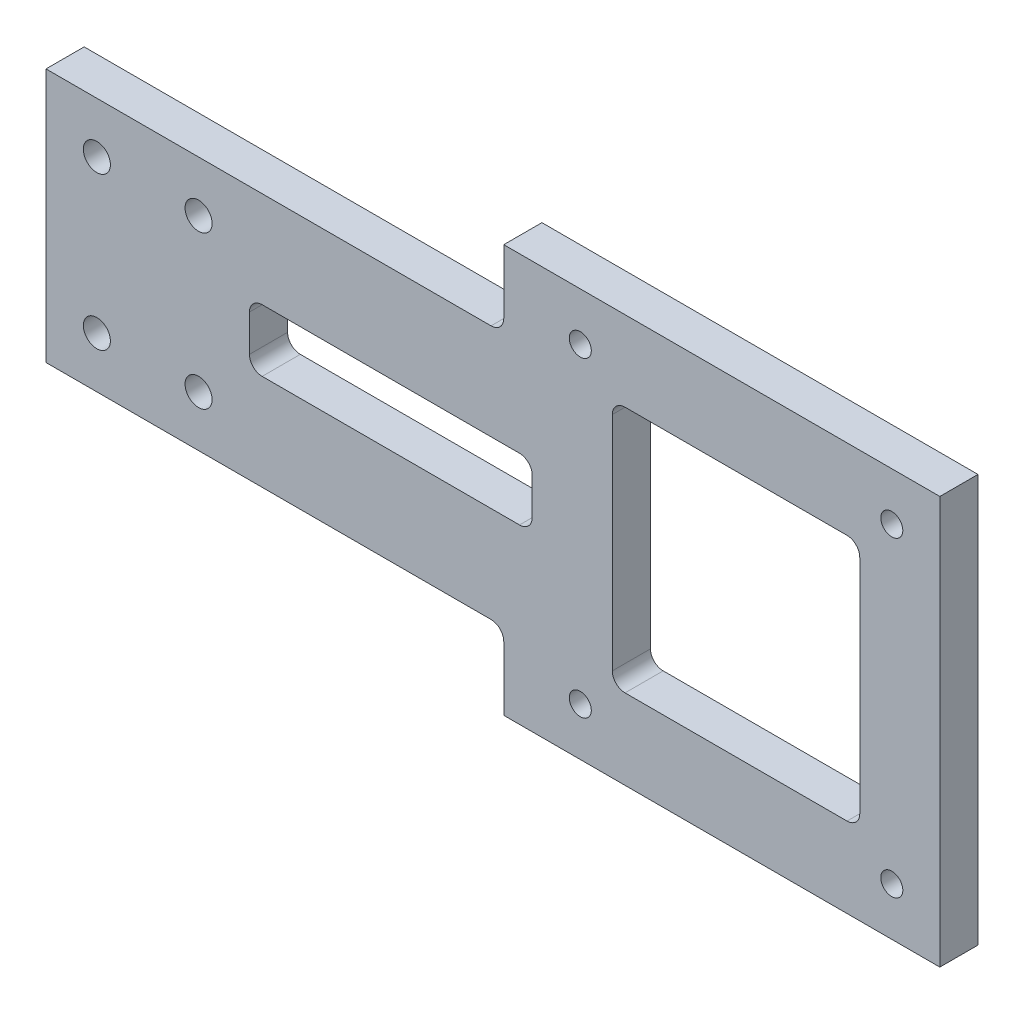
from build123d import *

# Parameters (mm, degrees)
BOSS_EXTRUDE1_DEPTH         = 9.525
M5_CLEARANCE_HOLE1_D        = 5.5
M5_CLEARANCE_HOLE1_DEPTH    = 18.75
M5_CLEARANCE_HOLE1_TIP      = 1.652366702
FILLET1_R                   = 3.175
F_1_4_CLEARANCE_HOLE1_D     = 6.7564
F_1_4_CLEARANCE_HOLE1_DEPTH = 18.75
F_1_4_CLEARANCE_HOLE1_TIP   = 2.029827343
SKETCH7_W                   = 70.609127035
SKETCH7_H                   = 15.5
CUT_EXTRUDE1_DEPTH          = 199.318467163
FILLET2_R                   = 3.175
SKETCH8_W                   = 20
SKETCH8_H                   = 61.78174593
BOSS_EXTRUDE2_DEPTH         = 9.525
FILLET3_R                   = 3.175


with BuildPart() as part:
    # Sketch1 → Boss-Extrude1 (new body)
    with BuildSketch(Plane.XY):
        Polygon((82.55, 31.75), (82.55, 50.890872965), (191.440872965, 50.890872965), (191.440872965, 30.890872965), (109.659127035, 30.890872965), (109.659127035, -30.890872965), (191.440872965, -30.890872965), (191.440872965, -50.890872965), (82.55, -50.890872965), (82.55, -31.75), (-31.75, -31.75), (-31.75, 31.75), align=None)
    extrude(amount=BOSS_EXTRUDE1_DEPTH)

    # M5 Clearance Hole1
    with Locations(Plane.XY.offset(9.525)):
        with Locations((179.440872965, 38.890872965), (179.440872965, -38.890872965), (101.659127035, 38.890872965), (101.659127035, -38.890872965)):
            Hole(M5_CLEARANCE_HOLE1_D / 2, depth=M5_CLEARANCE_HOLE1_DEPTH)
            with Locations((0, 0, -(M5_CLEARANCE_HOLE1_DEPTH + M5_CLEARANCE_HOLE1_TIP / 2))):  # 118° drill point
                Cone(0, M5_CLEARANCE_HOLE1_D / 2, M5_CLEARANCE_HOLE1_TIP, mode=Mode.SUBTRACT)

    # Fillet1
    fillet1_edges = [part.edges().sort_by_distance(p)[0] for p in [
        (82.55, 31.75, 4.7625),
        (109.659127035, 30.890872965, 4.7625),
        (109.659127035, -30.890872965, 4.7625),
        (82.55, -31.75, 4.7625),
    ]]
    fillet(fillet1_edges, radius=FILLET1_R)

    # 1/4 Clearance Hole1
    with Locations(Plane.XY.offset(9.525)):
        with Locations((-19.05, 19.05), (6.35, 19.05), (6.35, -19.05), (-19.05, -19.05)):
            Hole(F_1_4_CLEARANCE_HOLE1_D / 2, depth=F_1_4_CLEARANCE_HOLE1_DEPTH)
            with Locations((0, 0, -(F_1_4_CLEARANCE_HOLE1_DEPTH + F_1_4_CLEARANCE_HOLE1_TIP / 2))):  # 118° drill point
                Cone(0, F_1_4_CLEARANCE_HOLE1_D / 2, F_1_4_CLEARANCE_HOLE1_TIP, mode=Mode.SUBTRACT)

    # Sketch7 → Cut-Extrude1 (cut, through all)
    with BuildSketch(Plane.XY.offset(9.525)):
        with Locations((54.354563518, 0)):
            Rectangle(SKETCH7_W, SKETCH7_H)
    extrude(amount=-CUT_EXTRUDE1_DEPTH, mode=Mode.SUBTRACT)

    # Fillet2
    fillet2_edges = [part.edges().sort_by_distance(p)[0] for p in [
        (19.05, -7.75, 4.7625),
        (19.05, 7.75, 4.7625),
        (89.659127035, 7.75, 4.7625),
        (89.659127035, -7.75, 4.7625),
    ]]
    fillet(fillet2_edges, radius=FILLET2_R)

    # Sketch8 → Boss-Extrude2 (add)
    with BuildSketch(Plane.XY.offset(9.525)):
        with Locations((181.440872965, 0)):
            Rectangle(SKETCH8_W, SKETCH8_H)
    extrude(amount=-BOSS_EXTRUDE2_DEPTH)

    # Fillet3
    fillet3_edges = [part.edges().sort_by_distance(p)[0] for p in [
        (171.440872965, 30.890872965, 4.7625),
        (171.440872965, -30.890872965, 4.7625),
    ]]
    fillet(fillet3_edges, radius=FILLET3_R)


solid = part.part
